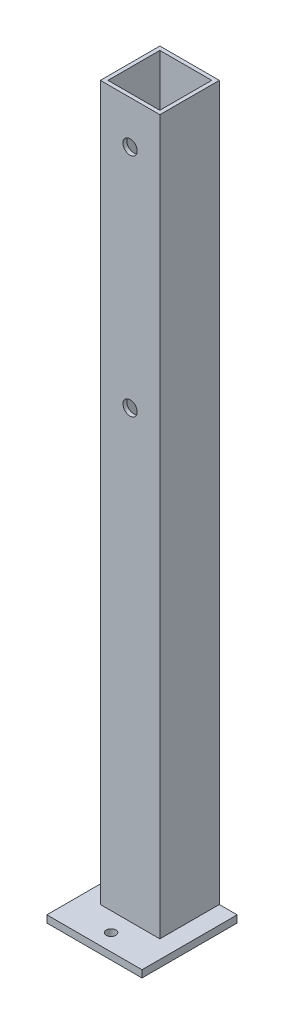
from build123d import *

# Parameters (mm, degrees)
SKETCH1_W           = 25
SKETCH1_H           = 25
SKETCH1_W_2         = 21.8
SKETCH1_H_2         = 21.8
BOSS_EXTRUDE1_DEPTH = 300
SKETCH2_W           = 40
SKETCH2_H           = 40
BOSS_EXTRUDE2_DEPTH = 3
CUT_EXTRUDE1_REACH  = 303.703
SKETCH3_R           = 3
CUT_EXTRUDE2_REACH  = 303.921
SKETCH4_R           = 2


with BuildPart() as part:
    # Sketch1 → Boss-Extrude1 (new body)
    with BuildSketch(Plane(origin=(0, 0, 0), x_dir=(1, 0, 0), z_dir=(0, 1, 0))):
        Rectangle(SKETCH1_W, SKETCH1_H)
        Rectangle(SKETCH1_W_2, SKETCH1_H_2, mode=Mode.SUBTRACT)
    extrude(amount=BOSS_EXTRUDE1_DEPTH)

    # Sketch2 → Boss-Extrude2 (add)
    with BuildSketch(Plane.XZ):
        with Locations((0, 7.5)):
            Rectangle(SKETCH2_W, SKETCH2_H)
    extrude(amount=BOSS_EXTRUDE2_DEPTH)

    # Sketch3 → Cut-Extrude1 (cut, up to next)
    with BuildSketch(Plane.XY.offset(12.5), mode=Mode.PRIVATE) as cut_extrude1_sk1:
        with Locations((0, 187)):
            Circle(SKETCH3_R)
    cut_extrude1_tool1 = extrude(cut_extrude1_sk1.sketch, amount=-CUT_EXTRUDE1_REACH, mode=Mode.PRIVATE) & part.part
    # Sketch3 → Cut-Extrude1 (cut, up to next)
    with BuildSketch(Plane.XY.offset(12.5), mode=Mode.PRIVATE) as cut_extrude1_sk2:
        with Locations((0, 282)):
            Circle(SKETCH3_R)
    cut_extrude1_tool2 = extrude(cut_extrude1_sk2.sketch, amount=-CUT_EXTRUDE1_REACH, mode=Mode.PRIVATE) & part.part
    add(cut_extrude1_tool1.solids().sort_by_distance((0, 187, 12.5))[0], mode=Mode.SUBTRACT)
    add(cut_extrude1_tool2.solids().sort_by_distance((0, 282, 12.5))[0], mode=Mode.SUBTRACT)

    # Sketch4 → Cut-Extrude2 (cut, up to next)
    with BuildSketch(Plane(origin=(0, 0, 0), x_dir=(1, 0, 0), z_dir=(0, 1, 0)), mode=Mode.PRIVATE) as cut_extrude2_sk1:
        with Locations(Location((0, -20.5, 0), (0, 0, 270))):
            Circle(SKETCH4_R)
    cut_extrude2_tool1 = extrude(cut_extrude2_sk1.sketch, amount=-CUT_EXTRUDE2_REACH, mode=Mode.PRIVATE) & part.part
    add(cut_extrude2_tool1.solids().sort_by_distance((0, 0, 20.5))[0], mode=Mode.SUBTRACT)


solid = part.part
